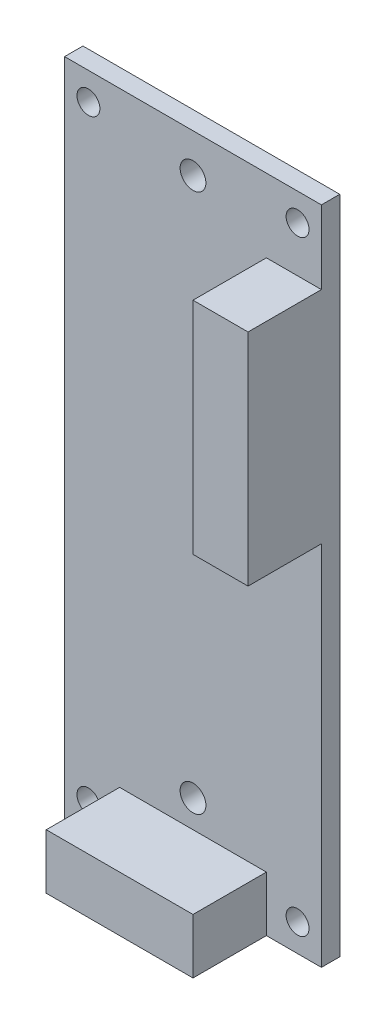
from build123d import *

# Parameters (mm, degrees)
SKETCH1_W                        = 35.56
SKETCH1_H                        = 91.44
EXTRUDE1_DEPTH                   = 2.54
F_28_0_1405_DIAMETER_HOLE1_D     = 3.5687
F_28_0_1405_DIAMETER_HOLE1_DEPTH = 15.24
F_28_0_1405_DIAMETER_HOLE1_TIP   = 1.072145646
EXTRUDE2_DEPTH                   = 10.16
SKETCH7_W                        = 7.62
SKETCH7_H                        = 30.48
EXTRUDE3_DEPTH                   = 10.16


with BuildPart() as part:
    # Sketch1 → Extrude1 (new body)
    with BuildSketch(Plane.XY):
        Rectangle(SKETCH1_W, SKETCH1_H)
    extrude(amount=EXTRUDE1_DEPTH)

    # Sketch3 → 1/8 (0.125) Diameter Hole1 (revolve, cut)
    with BuildSketch(Plane(origin=(14.478, 41.91, 2.54), x_dir=(0, -1, 0), z_dir=(1, 0, 0))):
        Polygon((0, 0), (0, 16.193866233), (1.5875, 15.24), (1.5875, 0), align=None)
    f_1_8_0_125_diameter_hole1 = revolve(axis=Axis((14.478, 41.91, 8.89), (0, 0, -1)), mode=Mode.SUBTRACT)

    # Mirror1: 1/8 (0.125) Diameter Hole1 across plane
    add(f_1_8_0_125_diameter_hole1.mirror(Plane(origin=(0, 0, 0), x_dir=(0, 0, 1), z_dir=(1, 0, 0))), mode=Mode.SUBTRACT)

    # Mirror2: 1/8 (0.125) Diameter Hole1 across plane
    add(f_1_8_0_125_diameter_hole1.mirror(Plane.ZX), mode=Mode.SUBTRACT)

    # Mirror2 copy 1 sketch → Mirror2 copy 1 (revolve, cut)
    with BuildSketch(Plane(origin=(-14.478, -41.91, 2.54), x_dir=(0, 1, 0), z_dir=(-1, 0, 0))):
        Polygon((0, 0), (0, 16.193866233), (1.5875, 15.24), (1.5875, 0), align=None)
    revolve(axis=Axis((-14.478, -41.91, 8.89), (0, 0, -1)), mode=Mode.SUBTRACT)

    # #28 (0.1405) Diameter Hole1
    with Locations(Plane(origin=(0, -34.29, 2.54), x_dir=(1, 0, 0), z_dir=(0, 0, 1))):
        with Locations((0, 0), (0, 74.639874629)):
            Hole(F_28_0_1405_DIAMETER_HOLE1_D / 2, depth=F_28_0_1405_DIAMETER_HOLE1_DEPTH)
            with Locations((0, 0, -(F_28_0_1405_DIAMETER_HOLE1_DEPTH + F_28_0_1405_DIAMETER_HOLE1_TIP / 2))):  # 118° drill point
                Cone(0, F_28_0_1405_DIAMETER_HOLE1_D / 2, F_28_0_1405_DIAMETER_HOLE1_TIP, mode=Mode.SUBTRACT)

    # Sketch6 → Extrude2 (add)
    with BuildSketch(Plane.XY.offset(2.54)):
        Polygon((0, -45.72), (10.16, -45.72), (10.16, -38.1), (-10.16, -38.1), (-10.16, -45.72), align=None)
    extrude(amount=EXTRUDE2_DEPTH)

    # Sketch7 → Extrude3 (add)
    with BuildSketch(Plane.XY.offset(2.54)):
        with Locations((13.97, 20.32)):
            Rectangle(SKETCH7_W, SKETCH7_H)
    extrude(amount=EXTRUDE3_DEPTH)


solid = part.part
